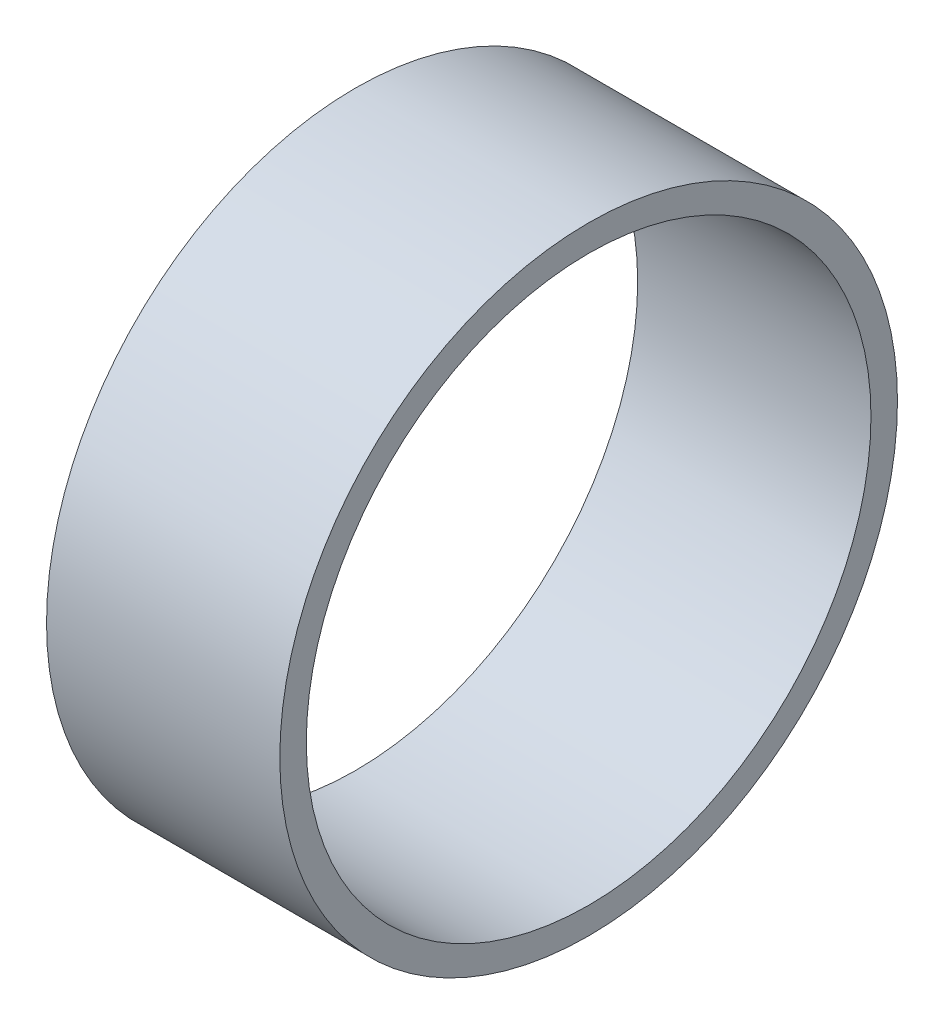
from build123d import *

# Parameters (mm, degrees)
SKETCH1_R           = 11.65
SKETCH1_R_2         = 10.65
BOSS_EXTRUDE1_DEPTH = 8.8


with BuildPart() as part:
    # Sketch1 → Boss-Extrude1 (new body)
    with BuildSketch(Plane(origin=(0, 0, 0), x_dir=(0, 0.04217318566384551, -0.9991103154361699), z_dir=(1, 0, 0))):
        with Locations(Location((28.542888787, 18.957113921, 0), (0, 0, 357.582937603))):
            Circle(SKETCH1_R)
        with Locations(Location((28.542888787, 18.957113921, 0), (0, 0, 357.582937603))):
            Circle(SKETCH1_R_2, mode=Mode.SUBTRACT)
    extrude(amount=BOSS_EXTRUDE1_DEPTH)


solid = part.part
